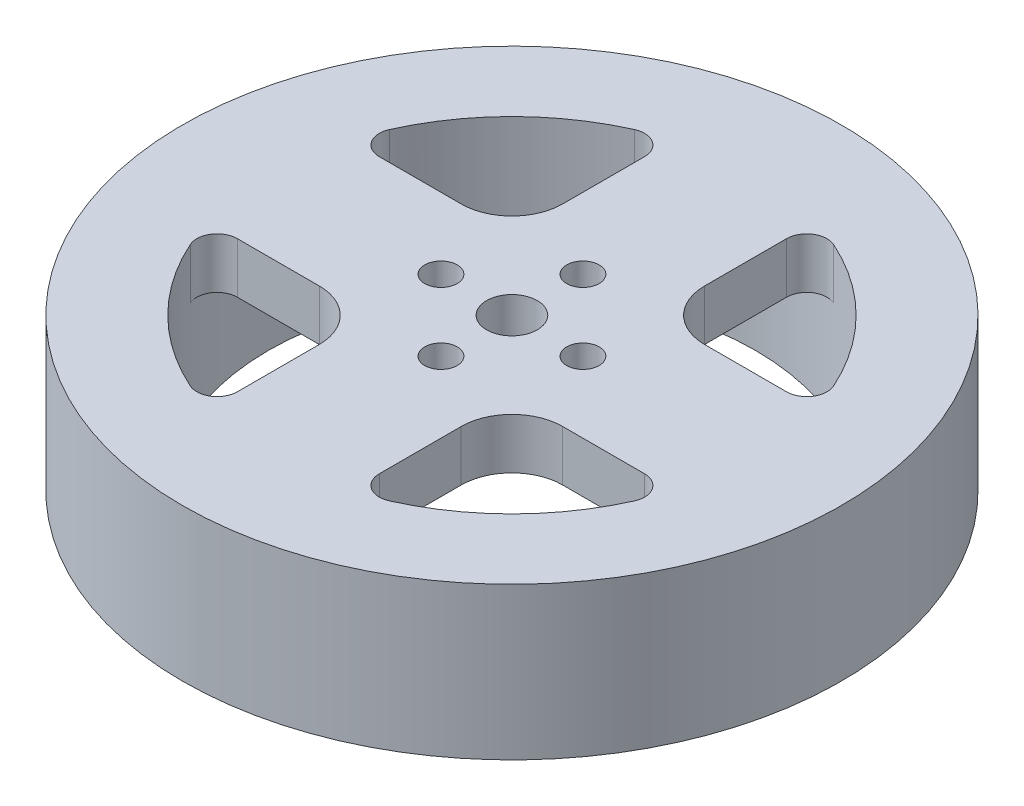
from build123d import *

# Parameters (mm, degrees)
SKETCH_1_R          = 32.5
EXTRUDE_1_DEPTH     = 15
SKETCH_2_R          = 1.6
CUT_EXTRUDE_1_DEPTH = 27
CUT_EXTRUDE_2_DEPTH = 15
FILLET_1_R          = 5
FILLET_2_R          = 2
CUT_EXTRUDE_START   = 10
SKETCH_4_R          = 24
CUT_EXTRUDE_3_DEPTH = 10
SKETCH_5_R          = 2.5
CUT_EXTRUDE_4_DEPTH = 10


with BuildPart() as part:
    # 草图1 → 凸台-拉伸1 (new body)
    with BuildSketch(Plane(origin=(0, 0, 0), x_dir=(1, 0, 0), z_dir=(0, 1, 0))):
        with Locations(Location((0, 0, 0), (0, 0, 270))):
            Circle(SKETCH_1_R)
    extrude(amount=EXTRUDE_1_DEPTH)

    # 草图2 → 切除-拉伸1 (cut)
    with BuildSketch(Plane(origin=(0, 15, 0), x_dir=(1, 0, 0), z_dir=(0, 1, 0))):
        with Locations(Location((7, 0, 0), (0, 0, 270))):
            Circle(SKETCH_2_R)
        with Locations(Location((0, -7, 0), (0, 0, 270))):
            Circle(SKETCH_2_R)
        with Locations(Location((-7, 0, 0), (0, 0, 270))):
            Circle(SKETCH_2_R)
        with Locations(Location((0, 7, 0), (0, 0, 270))):
            Circle(SKETCH_2_R)
    extrude(amount=-CUT_EXTRUDE_1_DEPTH, mode=Mode.SUBTRACT)

    # 草图3 → 切除-拉伸2 (cut)
    with BuildSketch(Plane(origin=(0, 15, 0), x_dir=(1, 0, 0), z_dir=(0, 1, 0))):
        with BuildLine():
            Line((7, 22.956480566), (7, 7))
            Line((7, 7), (22.956480566, 7))
            ThreePointArc((22.956480566, 7), (16.970562748, 16.970562748), (7, 22.956480566))
        make_face()
        with BuildLine():
            Line((-7, 7), (-22.956480566, 7))
            ThreePointArc((-22.956480566, 7), (-16.970562748, 16.970562748), (-7, 22.956480566))
            Line((-7, 22.956480566), (-7, 7))
        make_face()
        with BuildLine():
            Line((7, -7), (22.956480566, -7))
            ThreePointArc((22.956480566, -7), (16.970562748, -16.970562748), (7, -22.956480566))
            Line((7, -22.956480566), (7, -7))
        make_face()
        with BuildLine():
            Line((-7, -7), (-22.956480566, -7))
            ThreePointArc((-22.956480566, -7), (-16.970562748, -16.970562748), (-7, -22.956480566))
            Line((-7, -22.956480566), (-7, -7))
        make_face()
    extrude(amount=-CUT_EXTRUDE_2_DEPTH, mode=Mode.SUBTRACT)

    # 圆角1
    fillet_1_edges = [part.edges().sort_by_distance(p)[0] for p in [
        (-7, 7.5, -7),
        (7, 7.5, 7),
        (-7, 7.5, 7),
        (7, 7.5, -7),
    ]]
    fillet(fillet_1_edges, radius=FILLET_1_R)

    # 圆角2
    fillet_2_edges = [part.edges().sort_by_distance(p)[0] for p in [
        (-7, 7.5, -22.956480566),
        (-22.956480566, 7.5, -7),
        (7, 7.5, 22.956480566),
        (22.956480566, 7.5, 7),
        (-7, 7.5, 22.956480566),
        (-22.956480566, 7.5, 7),
        (7, 7.5, -22.956480566),
        (22.956480566, 7.5, -7),
    ]]
    fillet(fillet_2_edges, radius=FILLET_2_R)

    # 草图4 → 切除-拉伸3 (cut)
    with BuildSketch(Plane(origin=(0, 0, 0), x_dir=(1, 0, 0), z_dir=(0, 1, 0)).offset(CUT_EXTRUDE_START)):
        with Locations(Location((0, 0, 0), (0, 0, 270))):
            Circle(SKETCH_4_R)
    extrude(amount=-CUT_EXTRUDE_3_DEPTH, mode=Mode.SUBTRACT)

    # 草图5 → 切除-拉伸4 (cut)
    with BuildSketch(Plane(origin=(0, 15, 0), x_dir=(1, 0, 0), z_dir=(0, 1, 0))):
        with Locations(Location((0, 0, 0), (0, 0, 270))):
            Circle(SKETCH_5_R)
    extrude(amount=-CUT_EXTRUDE_4_DEPTH, mode=Mode.SUBTRACT)


solid = part.part
